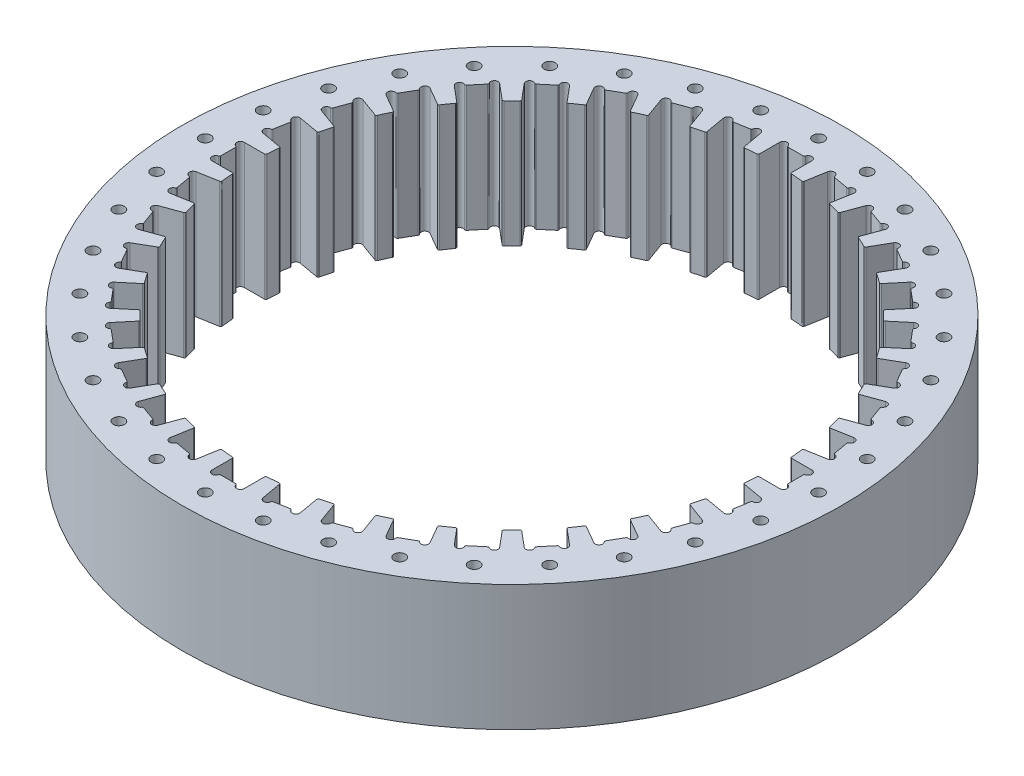
from build123d import *

# Parameters (mm, degrees)
SKETCH1_R           = 66.548
SKETCH1_R_2         = 1.1303
BOSS_EXTRUDE2_DEPTH = 25.4


with BuildPart() as part:
    # Sketch1 → Boss-Extrude2 (new body)
    with BuildSketch(Plane(origin=(0, 0, 0), x_dir=(1, 0, 0), z_dir=(0, 1, 0))):
        with Locations(Location((0, 0, 0), (0, 0, 270))):
            Circle(SKETCH1_R)
        with Locations(Location((30.9626, 53.628796334, 0), (0, 0, 270))):
            Circle(SKETCH1_R_2, mode=Mode.SUBTRACT)
        with Locations(Location((21.179665779, 58.190653481, 0), (0, 0, 270))):
            Circle(SKETCH1_R_2, mode=Mode.SUBTRACT)
        with Locations(Location((39.804751287, 47.437455349, 0), (0, 0, 270))):
            Circle(SKETCH1_R_2, mode=Mode.SUBTRACT)
        with Locations(Location((47.437455349, 39.804751287, 0), (0, 0, 270))):
            Circle(SKETCH1_R_2, mode=Mode.SUBTRACT)
        with Locations(Location((53.628796334, 30.9626, 0), (0, 0, 270))):
            Circle(SKETCH1_R_2, mode=Mode.SUBTRACT)
        with Locations(Location((58.190653481, 21.179665779, 0), (0, 0, 270))):
            Circle(SKETCH1_R_2, mode=Mode.SUBTRACT)
        with Locations(Location((60.984417067, 10.753198132, 0), (0, 0, 270))):
            Circle(SKETCH1_R_2, mode=Mode.SUBTRACT)
        with Locations(Location((61.9252, 0, 0), (0, 0, 270))):
            Circle(SKETCH1_R_2, mode=Mode.SUBTRACT)
        with Locations(Location((60.984417067, -10.753198132, 0), (0, 0, 270))):
            Circle(SKETCH1_R_2, mode=Mode.SUBTRACT)
        with Locations(Location((58.190653481, -21.179665779, 0), (0, 0, 270))):
            Circle(SKETCH1_R_2, mode=Mode.SUBTRACT)
        with Locations(Location((53.628796334, -30.9626, 0), (0, 0, 270))):
            Circle(SKETCH1_R_2, mode=Mode.SUBTRACT)
        with Locations(Location((47.437455349, -39.804751287, 0), (0, 0, 270))):
            Circle(SKETCH1_R_2, mode=Mode.SUBTRACT)
        with Locations(Location((39.804751287, -47.437455349, 0), (0, 0, 270))):
            Circle(SKETCH1_R_2, mode=Mode.SUBTRACT)
        with Locations(Location((30.9626, -53.628796334, 0), (0, 0, 270))):
            Circle(SKETCH1_R_2, mode=Mode.SUBTRACT)
        with Locations(Location((21.179665779, -58.190653481, 0), (0, 0, 270))):
            Circle(SKETCH1_R_2, mode=Mode.SUBTRACT)
        with Locations(Location((10.753198132, -60.984417067, 0), (0, 0, 270))):
            Circle(SKETCH1_R_2, mode=Mode.SUBTRACT)
        with Locations(Location((0, -61.9252, 0), (0, 0, 270))):
            Circle(SKETCH1_R_2, mode=Mode.SUBTRACT)
        with Locations(Location((-10.753198132, -60.984417067, 0), (0, 0, 270))):
            Circle(SKETCH1_R_2, mode=Mode.SUBTRACT)
        with Locations(Location((-21.179665779, -58.190653481, 0), (0, 0, 270))):
            Circle(SKETCH1_R_2, mode=Mode.SUBTRACT)
        with Locations(Location((-30.9626, -53.628796334, 0), (0, 0, 270))):
            Circle(SKETCH1_R_2, mode=Mode.SUBTRACT)
        with Locations(Location((-39.804751287, -47.437455349, 0), (0, 0, 270))):
            Circle(SKETCH1_R_2, mode=Mode.SUBTRACT)
        with Locations(Location((-47.437455349, -39.804751287, 0), (0, 0, 270))):
            Circle(SKETCH1_R_2, mode=Mode.SUBTRACT)
        with Locations(Location((-53.628796334, -30.9626, 0), (0, 0, 270))):
            Circle(SKETCH1_R_2, mode=Mode.SUBTRACT)
        with Locations(Location((-58.190653481, -21.179665779, 0), (0, 0, 270))):
            Circle(SKETCH1_R_2, mode=Mode.SUBTRACT)
        with Locations(Location((-60.984417067, -10.753198132, 0), (0, 0, 270))):
            Circle(SKETCH1_R_2, mode=Mode.SUBTRACT)
        with Locations(Location((-61.9252, 0, 0), (0, 0, 270))):
            Circle(SKETCH1_R_2, mode=Mode.SUBTRACT)
        with Locations(Location((-60.984417067, 10.753198132, 0), (0, 0, 270))):
            Circle(SKETCH1_R_2, mode=Mode.SUBTRACT)
        with Locations(Location((-58.190653481, 21.179665779, 0), (0, 0, 270))):
            Circle(SKETCH1_R_2, mode=Mode.SUBTRACT)
        with Locations(Location((-53.628796334, 30.9626, 0), (0, 0, 270))):
            Circle(SKETCH1_R_2, mode=Mode.SUBTRACT)
        with Locations(Location((-47.437455349, 39.804751287, 0), (0, 0, 270))):
            Circle(SKETCH1_R_2, mode=Mode.SUBTRACT)
        with Locations(Location((-39.804751287, 47.437455349, 0), (0, 0, 270))):
            Circle(SKETCH1_R_2, mode=Mode.SUBTRACT)
        with Locations(Location((-30.9626, 53.628796334, 0), (0, 0, 270))):
            Circle(SKETCH1_R_2, mode=Mode.SUBTRACT)
        with Locations(Location((-21.179665779, 58.190653481, 0), (0, 0, 270))):
            Circle(SKETCH1_R_2, mode=Mode.SUBTRACT)
        with Locations(Location((-10.753198132, 60.984417067, 0), (0, 0, 270))):
            Circle(SKETCH1_R_2, mode=Mode.SUBTRACT)
        with Locations(Location((0, 61.9252, 0), (0, 0, 270))):
            Circle(SKETCH1_R_2, mode=Mode.SUBTRACT)
        with Locations(Location((10.753198132, 60.984417067, 0), (0, 0, 270))):
            Circle(SKETCH1_R_2, mode=Mode.SUBTRACT)
        with BuildLine():
            Line((12.444179916, 51.851536724), (13.152264302, 55.867282831))
            ThreePointArc((13.152264302, 55.867282831), (12.627662659, 56.727372269), (11.708326336, 56.315326823))
            ThreePointArc((11.708326336, 56.315326823), (11.595465048, 56.195804536), (11.433048212, 56.170427013))
            Line((11.433048212, 56.170427013), (8.46786646, 56.693268559))
            ThreePointArc((8.46786646, 56.693268559), (8.323924181, 56.772665459), (8.258748292, 56.923580504))
            ThreePointArc((8.258748292, 56.923580504), (7.535782575, 57.625208111), (6.748650369, 56.996412741))
            Line((6.748650369, 56.996412741), (6.040565983, 52.980666634))
            ThreePointArc((6.040565983, 52.980666634), (5.942874586, 52.82161061), (5.762851362, 52.772274351))
            ThreePointArc((5.762851362, 52.772274351), (4.626749759, 52.883991743), (3.488508571, 52.971253562))
            ThreePointArc((3.488508571, 52.971253562), (3.319787456, 53.051100998), (3.2512, 53.224704536))
            Line((3.2512, 53.224704536), (3.2512, 57.3024))
            ThreePointArc((3.2512, 57.3024), (2.585215271, 58.058326627), (1.751396673, 57.4929))
            ThreePointArc((1.751396673, 57.4929), (1.661004829, 57.355595369), (1.50546223, 57.3024))
            Line((1.50546223, 57.3024), (-1.50546223, 57.3024))
            ThreePointArc((-1.50546223, 57.3024), (-1.661004829, 57.355595369), (-1.751396673, 57.4929))
            ThreePointArc((-1.751396673, 57.4929), (-2.585215271, 58.058326629), (-3.2512, 57.3024))
            Line((-3.2512, 57.3024), (-3.2512, 53.224704536))
            ThreePointArc((-3.2512, 53.224704536), (-3.319787456, 53.051100998), (-3.488508572, 52.971253562))
            ThreePointArc((-3.488508572, 52.971253562), (-4.62674976, 52.883991743), (-5.762851362, 52.772274351))
            ThreePointArc((-5.762851362, 52.772274351), (-5.942874586, 52.82161061), (-6.040565983, 52.980666634))
            Line((-6.040565983, 52.980666634), (-6.748650369, 56.996412741))
            ThreePointArc((-6.748650369, 56.996412741), (-7.535782575, 57.62520811), (-8.258748292, 56.923580504))
            ThreePointArc((-8.258748292, 56.923580504), (-8.323924181, 56.772665459), (-8.46786646, 56.693268559))
            Line((-8.46786646, 56.693268559), (-11.433048212, 56.170427013))
            ThreePointArc((-11.433048212, 56.170427013), (-11.595465048, 56.195804536), (-11.708326336, 56.315326823))
            ThreePointArc((-11.708326336, 56.315326823), (-12.62766266, 56.72737227), (-13.152264303, 55.867282831))
            Line((-13.152264303, 55.867282831), (-12.444179916, 51.851536724))
            ThreePointArc((-12.444179916, 51.851536724), (-12.481579437, 51.668660526), (-12.633871938, 51.560728039))
            ThreePointArc((-12.633871938, 51.560728039), (-13.739667828, 51.277138414), (-14.839109973, 50.969836288))
            ThreePointArc((-14.839109973, 50.969836288), (-15.024965392, 50.987162314), (-15.148792425, 51.126837986))
            Line((-15.148792425, 51.126837986), (-16.543446412, 54.958618323))
            ThreePointArc((-16.543446412, 54.958618323), (-17.427809481, 55.441176804), (-18.017955369, 54.624666819))
            ThreePointArc((-18.017955369, 54.624666819), (-18.055934968, 54.464726838), (-18.183903312, 54.361540841))
            Line((-18.183903312, 54.361540841), (-21.01324681, 53.331744026))
            ThreePointArc((-21.01324681, 53.331744026), (-21.177602929, 53.328532619), (-21.309504428, 53.426640937))
            ThreePointArc((-21.309504428, 53.426640937), (-22.286424908, 53.672785411), (-22.65370371, 52.734666543))
            Line((-22.65370371, 52.734666543), (-21.259049723, 48.902886206))
            ThreePointArc((-21.259049723, 48.902886206), (-21.264124942, 48.71629395), (-21.395361498, 48.583555884))
            ThreePointArc((-21.395361498, 48.583555884), (-22.435113043, 48.112255183), (-23.464489737, 47.618705541))
            ThreePointArc((-23.464489737, 47.618705541), (-23.650530227, 47.603494891), (-23.796730475, 47.719546237))
            Line((-23.796730475, 47.719546237), (-25.835578207, 51.250934098))
            ThreePointArc((-25.835578207, 51.250934098), (-26.790301215, 51.572593396), (-27.229695989, 50.666010274))
            ThreePointArc((-27.229695989, 50.666010274), (-27.239325307, 50.501905053), (-27.347431464, 50.378065213))
            Line((-27.347431464, 50.378065213), (-29.954968536, 48.872602983))
            ThreePointArc((-29.954968536, 48.872602983), (-30.116270062, 48.840900224), (-30.263204011, 48.914613601))
            ThreePointArc((-30.263204011, 48.914613601), (-31.268025413, 48.987378126), (-31.466821793, 47.999734098))
            Line((-31.466821793, 47.999734098), (-29.427974061, 44.468346237))
            ThreePointArc((-29.427974061, 44.468346237), (-29.400570771, 44.283707435), (-29.506763825, 44.130196969))
            ThreePointArc((-29.506763825, 44.130196969), (-30.4488787, 43.485505423), (-31.376912854, 42.820704522))
            ThreePointArc((-31.376912854, 42.820704522), (-31.557485669, 42.773419364), (-31.721616912, 42.862320223))
            Line((-31.721616912, 42.862320223), (-34.342709032, 45.986016174))
            ThreePointArc((-34.342709032, 45.986016174), (-35.338783203, 46.137002834), (-35.614076076, 45.167892645))
            ThreePointArc((-35.614076076, 45.167892645), (-35.59506253, 45.004608438), (-35.68002175, 44.863877566))
            Line((-35.68002175, 44.863877566), (-37.986523701, 42.928492629))
            ThreePointArc((-37.986523701, 42.928492629), (-38.139869568, 42.86926179), (-38.297371454, 42.916340483))
            ThreePointArc((-38.297371454, 42.916340483), (-39.299562789, 42.813514146), (-39.323836419, 41.806354021))
            Line((-39.323836419, 41.806354021), (-36.702744299, 38.68265807))
            ThreePointArc((-36.702744299, 38.68265807), (-36.643695135, 38.505582877), (-36.721618065, 38.33596435))
            ThreePointArc((-36.721618065, 38.33596435), (-37.537470586, 37.537470586), (-38.33596435, 36.721618065))
            ThreePointArc((-38.33596435, 36.721618065), (-38.505582877, 36.643695135), (-38.68265807, 36.702744298))
            Line((-38.68265807, 36.702744298), (-41.806354021, 39.323836419))
            ThreePointArc((-41.806354021, 39.323836419), (-42.813514145, 39.299562788), (-42.916340483, 38.297371454))
            ThreePointArc((-42.916340483, 38.297371454), (-42.86926179, 38.139869568), (-42.928492629, 37.986523701))
            Line((-42.928492629, 37.986523701), (-44.863877566, 35.68002175))
            ThreePointArc((-44.863877566, 35.68002175), (-45.004608438, 35.59506253), (-45.167892645, 35.614076076))
            ThreePointArc((-45.167892645, 35.614076076), (-46.137002835, 35.338783203), (-45.986016174, 34.342709032))
            Line((-45.986016174, 34.342709032), (-42.862320223, 31.721616911))
            ThreePointArc((-42.862320223, 31.721616911), (-42.773419364, 31.557485668), (-42.820704522, 31.376912853))
            ThreePointArc((-42.820704522, 31.376912853), (-43.485505423, 30.4488787), (-44.13019697, 29.506763825))
            ThreePointArc((-44.13019697, 29.506763825), (-44.283707435, 29.400570771), (-44.468346237, 29.427974061))
            Line((-44.468346237, 29.427974061), (-47.999734098, 31.466821793))
            ThreePointArc((-47.999734098, 31.466821793), (-48.987378125, 31.268025412), (-48.914613601, 30.263204011))
            ThreePointArc((-48.914613601, 30.263204011), (-48.840900224, 30.116270062), (-48.872602983, 29.954968536))
            Line((-48.872602983, 29.954968536), (-50.378065213, 27.347431464))
            ThreePointArc((-50.378065213, 27.347431464), (-50.501905053, 27.239325307), (-50.666010274, 27.229695989))
            ThreePointArc((-50.666010274, 27.229695989), (-51.572593397, 26.790301215), (-51.250934098, 25.835578207))
            Line((-51.250934098, 25.835578207), (-47.719546237, 23.796730475))
            ThreePointArc((-47.719546237, 23.796730475), (-47.603494891, 23.650530227), (-47.618705541, 23.464489737))
            ThreePointArc((-47.618705541, 23.464489737), (-48.112255183, 22.435113043), (-48.583555885, 21.395361497))
            ThreePointArc((-48.583555885, 21.395361497), (-48.716293951, 21.264124942), (-48.902886206, 21.259049722))
            Line((-48.902886206, 21.259049722), (-52.734666543, 22.653703709))
            ThreePointArc((-52.734666543, 22.653703709), (-53.67278541, 22.286424907), (-53.426640937, 21.309504428))
            ThreePointArc((-53.426640937, 21.309504428), (-53.328532619, 21.177602929), (-53.331744026, 21.01324681))
            Line((-53.331744026, 21.01324681), (-54.361540841, 18.183903312))
            ThreePointArc((-54.361540841, 18.183903312), (-54.464726838, 18.055934968), (-54.624666819, 18.017955369))
            ThreePointArc((-54.624666819, 18.017955369), (-55.441176806, 17.427809481), (-54.958618323, 16.543446412))
            Line((-54.958618323, 16.543446412), (-51.126837986, 15.148792425))
            ThreePointArc((-51.126837986, 15.148792425), (-50.987162314, 15.024965392), (-50.969836288, 14.839109973))
            ThreePointArc((-50.969836288, 14.839109973), (-51.277138414, 13.739667828), (-51.560728039, 12.633871937))
            ThreePointArc((-51.560728039, 12.633871937), (-51.668660526, 12.481579436), (-51.851536724, 12.444179916))
            Line((-51.851536724, 12.444179916), (-55.867282831, 13.152264302))
            ThreePointArc((-55.867282831, 13.152264302), (-56.727372269, 12.627662659), (-56.315326823, 11.708326336))
            ThreePointArc((-56.315326823, 11.708326336), (-56.195804536, 11.595465048), (-56.170427013, 11.433048212))
            Line((-56.170427013, 11.433048212), (-56.693268559, 8.46786646))
            ThreePointArc((-56.693268559, 8.46786646), (-56.772665459, 8.323924181), (-56.923580504, 8.258748292))
            ThreePointArc((-56.923580504, 8.258748292), (-57.625208111, 7.535782575), (-56.996412741, 6.748650369))
            Line((-56.996412741, 6.748650369), (-52.980666634, 6.040565983))
            ThreePointArc((-52.980666634, 6.040565983), (-52.82161061, 5.942874586), (-52.772274351, 5.762851362))
            ThreePointArc((-52.772274351, 5.762851362), (-52.883991743, 4.626749759), (-52.971253562, 3.488508571))
            ThreePointArc((-52.971253562, 3.488508571), (-53.051100998, 3.319787456), (-53.224704536, 3.2512))
            Line((-53.224704536, 3.2512), (-57.3024, 3.2512))
            ThreePointArc((-57.3024, 3.2512), (-58.058326627, 2.585215271), (-57.4929, 1.751396673))
            ThreePointArc((-57.4929, 1.751396673), (-57.355595369, 1.661004829), (-57.3024, 1.50546223))
            Line((-57.3024, 1.50546223), (-57.3024, -1.50546223))
            ThreePointArc((-57.3024, -1.50546223), (-57.355595369, -1.661004829), (-57.4929, -1.751396673))
            ThreePointArc((-57.4929, -1.751396673), (-58.058326629, -2.585215271), (-57.3024, -3.2512))
            Line((-57.3024, -3.2512), (-53.224704536, -3.2512))
            ThreePointArc((-53.224704536, -3.2512), (-53.051100998, -3.319787456), (-52.971253562, -3.488508572))
            ThreePointArc((-52.971253562, -3.488508572), (-52.883991743, -4.62674976), (-52.772274351, -5.762851362))
            ThreePointArc((-52.772274351, -5.762851362), (-52.82161061, -5.942874586), (-52.980666634, -6.040565983))
            Line((-52.980666634, -6.040565983), (-56.996412741, -6.748650369))
            ThreePointArc((-56.996412741, -6.748650369), (-57.62520811, -7.535782575), (-56.923580504, -8.258748292))
            ThreePointArc((-56.923580504, -8.258748292), (-56.772665459, -8.323924181), (-56.693268559, -8.46786646))
            Line((-56.693268559, -8.46786646), (-56.170427013, -11.433048212))
            ThreePointArc((-56.170427013, -11.433048212), (-56.195804536, -11.595465048), (-56.315326823, -11.708326336))
            ThreePointArc((-56.315326823, -11.708326336), (-56.72737227, -12.62766266), (-55.867282831, -13.152264303))
            Line((-55.867282831, -13.152264303), (-51.851536724, -12.444179916))
            ThreePointArc((-51.851536724, -12.444179916), (-51.668660526, -12.481579437), (-51.560728039, -12.633871938))
            ThreePointArc((-51.560728039, -12.633871938), (-51.277138414, -13.739667828), (-50.969836288, -14.839109973))
            ThreePointArc((-50.969836288, -14.839109973), (-50.987162314, -15.024965392), (-51.126837986, -15.148792425))
            Line((-51.126837986, -15.148792425), (-54.958618323, -16.543446412))
            ThreePointArc((-54.958618323, -16.543446412), (-55.441176804, -17.427809481), (-54.624666819, -18.017955369))
            ThreePointArc((-54.624666819, -18.017955369), (-54.464726838, -18.055934968), (-54.361540841, -18.183903312))
            Line((-54.361540841, -18.183903312), (-53.331744026, -21.01324681))
            ThreePointArc((-53.331744026, -21.01324681), (-53.328532619, -21.177602929), (-53.426640937, -21.309504428))
            ThreePointArc((-53.426640937, -21.309504428), (-53.672785411, -22.286424908), (-52.734666543, -22.65370371))
            Line((-52.734666543, -22.65370371), (-48.902886206, -21.259049723))
            ThreePointArc((-48.902886206, -21.259049723), (-48.71629395, -21.264124942), (-48.583555884, -21.395361498))
            ThreePointArc((-48.583555884, -21.395361498), (-48.112255183, -22.435113043), (-47.618705541, -23.464489737))
            ThreePointArc((-47.618705541, -23.464489737), (-47.603494891, -23.650530227), (-47.719546237, -23.796730475))
            Line((-47.719546237, -23.796730475), (-51.250934098, -25.835578207))
            ThreePointArc((-51.250934098, -25.835578207), (-51.572593396, -26.790301215), (-50.666010274, -27.229695989))
            ThreePointArc((-50.666010274, -27.229695989), (-50.501905053, -27.239325307), (-50.378065213, -27.347431464))
            Line((-50.378065213, -27.347431464), (-48.872602983, -29.954968536))
            ThreePointArc((-48.872602983, -29.954968536), (-48.840900224, -30.116270062), (-48.914613601, -30.263204011))
            ThreePointArc((-48.914613601, -30.263204011), (-48.987378126, -31.268025413), (-47.999734098, -31.466821793))
            Line((-47.999734098, -31.466821793), (-44.468346237, -29.427974061))
            ThreePointArc((-44.468346237, -29.427974061), (-44.283707435, -29.400570771), (-44.130196969, -29.506763825))
            ThreePointArc((-44.130196969, -29.506763825), (-43.485505423, -30.4488787), (-42.820704522, -31.376912854))
            ThreePointArc((-42.820704522, -31.376912854), (-42.773419364, -31.557485669), (-42.862320223, -31.721616912))
            Line((-42.862320223, -31.721616912), (-45.986016174, -34.342709032))
            ThreePointArc((-45.986016174, -34.342709032), (-46.137002834, -35.338783203), (-45.167892645, -35.614076076))
            ThreePointArc((-45.167892645, -35.614076076), (-45.004608438, -35.59506253), (-44.863877566, -35.68002175))
            Line((-44.863877566, -35.68002175), (-42.928492629, -37.986523701))
            ThreePointArc((-42.928492629, -37.986523701), (-42.86926179, -38.139869568), (-42.916340483, -38.297371454))
            ThreePointArc((-42.916340483, -38.297371454), (-42.813514146, -39.299562789), (-41.806354021, -39.323836419))
            Line((-41.806354021, -39.323836419), (-38.68265807, -36.702744299))
            ThreePointArc((-38.68265807, -36.702744299), (-38.505582877, -36.643695135), (-38.33596435, -36.721618065))
            ThreePointArc((-38.33596435, -36.721618065), (-37.537470586, -37.537470586), (-36.721618065, -38.33596435))
            ThreePointArc((-36.721618065, -38.33596435), (-36.643695135, -38.505582877), (-36.702744298, -38.68265807))
            Line((-36.702744298, -38.68265807), (-39.323836419, -41.806354021))
            ThreePointArc((-39.323836419, -41.806354021), (-39.299562788, -42.813514145), (-38.297371454, -42.916340483))
            ThreePointArc((-38.297371454, -42.916340483), (-38.139869568, -42.86926179), (-37.986523701, -42.928492629))
            Line((-37.986523701, -42.928492629), (-35.68002175, -44.863877566))
            ThreePointArc((-35.68002175, -44.863877566), (-35.59506253, -45.004608438), (-35.614076076, -45.167892645))
            ThreePointArc((-35.614076076, -45.167892645), (-35.338783203, -46.137002835), (-34.342709032, -45.986016174))
            Line((-34.342709032, -45.986016174), (-31.721616911, -42.862320223))
            ThreePointArc((-31.721616911, -42.862320223), (-31.557485668, -42.773419364), (-31.376912853, -42.820704522))
            ThreePointArc((-31.376912853, -42.820704522), (-30.4488787, -43.485505423), (-29.506763825, -44.13019697))
            ThreePointArc((-29.506763825, -44.13019697), (-29.400570771, -44.283707435), (-29.427974061, -44.468346237))
            Line((-29.427974061, -44.468346237), (-31.466821793, -47.999734098))
            ThreePointArc((-31.466821793, -47.999734098), (-31.268025412, -48.987378125), (-30.263204011, -48.914613601))
            ThreePointArc((-30.263204011, -48.914613601), (-30.116270062, -48.840900224), (-29.954968536, -48.872602983))
            Line((-29.954968536, -48.872602983), (-27.347431464, -50.378065213))
            ThreePointArc((-27.347431464, -50.378065213), (-27.239325307, -50.501905053), (-27.229695989, -50.666010274))
            ThreePointArc((-27.229695989, -50.666010274), (-26.790301215, -51.572593397), (-25.835578207, -51.250934098))
            Line((-25.835578207, -51.250934098), (-23.796730475, -47.719546237))
            ThreePointArc((-23.796730475, -47.719546237), (-23.650530227, -47.603494891), (-23.464489737, -47.618705541))
            ThreePointArc((-23.464489737, -47.618705541), (-22.435113043, -48.112255183), (-21.395361497, -48.583555885))
            ThreePointArc((-21.395361497, -48.583555885), (-21.264124942, -48.716293951), (-21.259049722, -48.902886206))
            Line((-21.259049722, -48.902886206), (-22.653703709, -52.734666543))
            ThreePointArc((-22.653703709, -52.734666543), (-22.286424907, -53.67278541), (-21.309504428, -53.426640937))
            ThreePointArc((-21.309504428, -53.426640937), (-21.177602929, -53.328532619), (-21.01324681, -53.331744026))
            Line((-21.01324681, -53.331744026), (-18.183903312, -54.361540841))
            ThreePointArc((-18.183903312, -54.361540841), (-18.055934968, -54.464726838), (-18.017955369, -54.624666819))
            ThreePointArc((-18.017955369, -54.624666819), (-17.427809481, -55.441176806), (-16.543446412, -54.958618323))
            Line((-16.543446412, -54.958618323), (-15.148792425, -51.126837986))
            ThreePointArc((-15.148792425, -51.126837986), (-15.024965392, -50.987162314), (-14.839109973, -50.969836288))
            ThreePointArc((-14.839109973, -50.969836288), (-13.739667828, -51.277138414), (-12.633871937, -51.560728039))
            ThreePointArc((-12.633871937, -51.560728039), (-12.481579436, -51.668660526), (-12.444179916, -51.851536724))
            Line((-12.444179916, -51.851536724), (-13.152264302, -55.867282831))
            ThreePointArc((-13.152264302, -55.867282831), (-12.627662659, -56.727372269), (-11.708326336, -56.315326823))
            ThreePointArc((-11.708326336, -56.315326823), (-11.595465048, -56.195804536), (-11.433048212, -56.170427013))
            Line((-11.433048212, -56.170427013), (-8.46786646, -56.693268559))
            ThreePointArc((-8.46786646, -56.693268559), (-8.323924181, -56.772665459), (-8.258748292, -56.923580504))
            ThreePointArc((-8.258748292, -56.923580504), (-7.535782575, -57.625208111), (-6.748650369, -56.996412741))
            Line((-6.748650369, -56.996412741), (-6.040565983, -52.980666634))
            ThreePointArc((-6.040565983, -52.980666634), (-5.942874586, -52.82161061), (-5.762851362, -52.772274351))
            ThreePointArc((-5.762851362, -52.772274351), (-4.626749759, -52.883991743), (-3.488508571, -52.971253562))
            ThreePointArc((-3.488508571, -52.971253562), (-3.319787456, -53.051100998), (-3.2512, -53.224704536))
            Line((-3.2512, -53.224704536), (-3.2512, -57.3024))
            ThreePointArc((-3.2512, -57.3024), (-2.585215271, -58.058326627), (-1.751396673, -57.4929))
            ThreePointArc((-1.751396673, -57.4929), (-1.661004829, -57.355595369), (-1.50546223, -57.3024))
            Line((-1.50546223, -57.3024), (1.50546223, -57.3024))
            ThreePointArc((1.50546223, -57.3024), (1.661004829, -57.355595369), (1.751396673, -57.4929))
            ThreePointArc((1.751396673, -57.4929), (2.585215271, -58.058326629), (3.2512, -57.3024))
            Line((3.2512, -57.3024), (3.2512, -53.224704536))
            ThreePointArc((3.2512, -53.224704536), (3.319787456, -53.051100998), (3.488508572, -52.971253562))
            ThreePointArc((3.488508572, -52.971253562), (4.62674976, -52.883991743), (5.762851362, -52.772274351))
            ThreePointArc((5.762851362, -52.772274351), (5.942874586, -52.82161061), (6.040565983, -52.980666634))
            Line((6.040565983, -52.980666634), (6.748650369, -56.996412741))
            ThreePointArc((6.748650369, -56.996412741), (7.535782575, -57.62520811), (8.258748292, -56.923580504))
            ThreePointArc((8.258748292, -56.923580504), (8.323924181, -56.772665459), (8.46786646, -56.693268559))
            Line((8.46786646, -56.693268559), (11.433048212, -56.170427013))
            ThreePointArc((11.433048212, -56.170427013), (11.595465048, -56.195804536), (11.708326336, -56.315326823))
            ThreePointArc((11.708326336, -56.315326823), (12.62766266, -56.72737227), (13.152264303, -55.867282831))
            Line((13.152264303, -55.867282831), (12.444179916, -51.851536724))
            ThreePointArc((12.444179916, -51.851536724), (12.481579437, -51.668660526), (12.633871938, -51.560728039))
            ThreePointArc((12.633871938, -51.560728039), (13.739667828, -51.277138414), (14.839109973, -50.969836288))
            ThreePointArc((14.839109973, -50.969836288), (15.024965392, -50.987162314), (15.148792425, -51.126837986))
            Line((15.148792425, -51.126837986), (16.543446412, -54.958618323))
            ThreePointArc((16.543446412, -54.958618323), (17.427809481, -55.441176804), (18.017955369, -54.624666819))
            ThreePointArc((18.017955369, -54.624666819), (18.055934968, -54.464726838), (18.183903312, -54.361540841))
            Line((18.183903312, -54.361540841), (21.01324681, -53.331744026))
            ThreePointArc((21.01324681, -53.331744026), (21.177602929, -53.328532619), (21.309504428, -53.426640937))
            ThreePointArc((21.309504428, -53.426640937), (22.286424908, -53.672785411), (22.65370371, -52.734666543))
            Line((22.65370371, -52.734666543), (21.259049723, -48.902886206))
            ThreePointArc((21.259049723, -48.902886206), (21.264124942, -48.71629395), (21.395361498, -48.583555884))
            ThreePointArc((21.395361498, -48.583555884), (22.435113043, -48.112255183), (23.464489737, -47.618705541))
            ThreePointArc((23.464489737, -47.618705541), (23.650530227, -47.603494891), (23.796730475, -47.719546237))
            Line((23.796730475, -47.719546237), (25.835578207, -51.250934098))
            ThreePointArc((25.835578207, -51.250934098), (26.790301215, -51.572593396), (27.229695989, -50.666010274))
            ThreePointArc((27.229695989, -50.666010274), (27.239325307, -50.501905053), (27.347431464, -50.378065213))
            Line((27.347431464, -50.378065213), (29.954968536, -48.872602983))
            ThreePointArc((29.954968536, -48.872602983), (30.116270062, -48.840900224), (30.263204011, -48.914613601))
            ThreePointArc((30.263204011, -48.914613601), (31.268025413, -48.987378126), (31.466821793, -47.999734098))
            Line((31.466821793, -47.999734098), (29.427974061, -44.468346237))
            ThreePointArc((29.427974061, -44.468346237), (29.400570771, -44.283707435), (29.506763825, -44.130196969))
            ThreePointArc((29.506763825, -44.130196969), (30.4488787, -43.485505423), (31.376912854, -42.820704522))
            ThreePointArc((31.376912854, -42.820704522), (31.557485669, -42.773419364), (31.721616912, -42.862320223))
            Line((31.721616912, -42.862320223), (34.342709032, -45.986016174))
            ThreePointArc((34.342709032, -45.986016174), (35.338783203, -46.137002834), (35.614076076, -45.167892645))
            ThreePointArc((35.614076076, -45.167892645), (35.59506253, -45.004608438), (35.68002175, -44.863877566))
            Line((35.68002175, -44.863877566), (37.986523701, -42.928492629))
            ThreePointArc((37.986523701, -42.928492629), (38.139869568, -42.86926179), (38.297371454, -42.916340483))
            ThreePointArc((38.297371454, -42.916340483), (39.299562789, -42.813514146), (39.323836419, -41.806354021))
            Line((39.323836419, -41.806354021), (36.702744299, -38.68265807))
            ThreePointArc((36.702744299, -38.68265807), (36.643695135, -38.505582877), (36.721618065, -38.33596435))
            ThreePointArc((36.721618065, -38.33596435), (37.537470586, -37.537470586), (38.33596435, -36.721618065))
            ThreePointArc((38.33596435, -36.721618065), (38.505582877, -36.643695135), (38.68265807, -36.702744298))
            Line((38.68265807, -36.702744298), (41.806354021, -39.323836419))
            ThreePointArc((41.806354021, -39.323836419), (42.813514145, -39.299562788), (42.916340483, -38.297371454))
            ThreePointArc((42.916340483, -38.297371454), (42.86926179, -38.139869568), (42.928492629, -37.986523701))
            Line((42.928492629, -37.986523701), (44.863877566, -35.68002175))
            ThreePointArc((44.863877566, -35.68002175), (45.004608438, -35.59506253), (45.167892645, -35.614076076))
            ThreePointArc((45.167892645, -35.614076076), (46.137002835, -35.338783203), (45.986016174, -34.342709032))
            Line((45.986016174, -34.342709032), (42.862320223, -31.721616911))
            ThreePointArc((42.862320223, -31.721616911), (42.773419364, -31.557485668), (42.820704522, -31.376912853))
            ThreePointArc((42.820704522, -31.376912853), (43.485505423, -30.4488787), (44.13019697, -29.506763825))
            ThreePointArc((44.13019697, -29.506763825), (44.283707435, -29.400570771), (44.468346237, -29.427974061))
            Line((44.468346237, -29.427974061), (47.999734098, -31.466821793))
            ThreePointArc((47.999734098, -31.466821793), (48.987378125, -31.268025412), (48.914613601, -30.263204011))
            ThreePointArc((48.914613601, -30.263204011), (48.840900224, -30.116270062), (48.872602983, -29.954968536))
            Line((48.872602983, -29.954968536), (50.378065213, -27.347431464))
            ThreePointArc((50.378065213, -27.347431464), (50.501905053, -27.239325307), (50.666010274, -27.229695989))
            ThreePointArc((50.666010274, -27.229695989), (51.572593397, -26.790301215), (51.250934098, -25.835578207))
            Line((51.250934098, -25.835578207), (47.719546237, -23.796730475))
            ThreePointArc((47.719546237, -23.796730475), (47.603494891, -23.650530227), (47.618705541, -23.464489737))
            ThreePointArc((47.618705541, -23.464489737), (48.112255183, -22.435113043), (48.583555885, -21.395361497))
            ThreePointArc((48.583555885, -21.395361497), (48.716293951, -21.264124942), (48.902886206, -21.259049722))
            Line((48.902886206, -21.259049722), (52.734666543, -22.653703709))
            ThreePointArc((52.734666543, -22.653703709), (53.67278541, -22.286424907), (53.426640937, -21.309504428))
            ThreePointArc((53.426640937, -21.309504428), (53.328532619, -21.177602929), (53.331744026, -21.01324681))
            Line((53.331744026, -21.01324681), (54.361540841, -18.183903312))
            ThreePointArc((54.361540841, -18.183903312), (54.464726838, -18.055934968), (54.624666819, -18.017955369))
            ThreePointArc((54.624666819, -18.017955369), (55.441176806, -17.427809481), (54.958618323, -16.543446412))
            Line((54.958618323, -16.543446412), (51.126837986, -15.148792425))
            ThreePointArc((51.126837986, -15.148792425), (50.987162314, -15.024965392), (50.969836288, -14.839109973))
            ThreePointArc((50.969836288, -14.839109973), (51.277138414, -13.739667828), (51.560728039, -12.633871937))
            ThreePointArc((51.560728039, -12.633871937), (51.668660526, -12.481579436), (51.851536724, -12.444179916))
            Line((51.851536724, -12.444179916), (55.867282831, -13.152264302))
            ThreePointArc((55.867282831, -13.152264302), (56.727372269, -12.627662659), (56.315326823, -11.708326336))
            ThreePointArc((56.315326823, -11.708326336), (56.195804536, -11.595465048), (56.170427013, -11.433048212))
            Line((56.170427013, -11.433048212), (56.693268559, -8.46786646))
            ThreePointArc((56.693268559, -8.46786646), (56.772665459, -8.323924181), (56.923580504, -8.258748292))
            ThreePointArc((56.923580504, -8.258748292), (57.625208111, -7.535782575), (56.996412741, -6.748650369))
            Line((56.996412741, -6.748650369), (52.980666634, -6.040565983))
            ThreePointArc((52.980666634, -6.040565983), (52.82161061, -5.942874586), (52.772274351, -5.762851362))
            ThreePointArc((52.772274351, -5.762851362), (52.883991743, -4.626749759), (52.971253562, -3.488508571))
            ThreePointArc((52.971253562, -3.488508571), (53.051100998, -3.319787456), (53.224704536, -3.2512))
            Line((53.224704536, -3.2512), (57.3024, -3.2512))
            ThreePointArc((57.3024, -3.2512), (58.058326627, -2.585215271), (57.4929, -1.751396673))
            ThreePointArc((57.4929, -1.751396673), (57.355595369, -1.661004829), (57.3024, -1.50546223))
            Line((57.3024, -1.50546223), (57.3024, 1.50546223))
            ThreePointArc((57.3024, 1.50546223), (57.355595369, 1.661004829), (57.4929, 1.751396673))
            ThreePointArc((57.4929, 1.751396673), (58.058326629, 2.585215271), (57.3024, 3.2512))
            Line((57.3024, 3.2512), (53.224704536, 3.2512))
            ThreePointArc((53.224704536, 3.2512), (53.051100998, 3.319787456), (52.971253562, 3.488508572))
            ThreePointArc((52.971253562, 3.488508572), (52.883991743, 4.62674976), (52.772274351, 5.762851362))
            ThreePointArc((52.772274351, 5.762851362), (52.82161061, 5.942874586), (52.980666634, 6.040565983))
            Line((52.980666634, 6.040565983), (56.996412741, 6.748650369))
            ThreePointArc((56.996412741, 6.748650369), (57.62520811, 7.535782575), (56.923580504, 8.258748292))
            ThreePointArc((56.923580504, 8.258748292), (56.772665459, 8.323924181), (56.693268559, 8.46786646))
            Line((56.693268559, 8.46786646), (56.170427013, 11.433048212))
            ThreePointArc((56.170427013, 11.433048212), (56.195804536, 11.595465048), (56.315326823, 11.708326336))
            ThreePointArc((56.315326823, 11.708326336), (56.72737227, 12.62766266), (55.867282831, 13.152264303))
            Line((55.867282831, 13.152264303), (51.851536724, 12.444179916))
            ThreePointArc((51.851536724, 12.444179916), (51.668660526, 12.481579437), (51.560728039, 12.633871938))
            ThreePointArc((51.560728039, 12.633871938), (51.277138414, 13.739667828), (50.969836288, 14.839109973))
            ThreePointArc((50.969836288, 14.839109973), (50.987162314, 15.024965392), (51.126837986, 15.148792425))
            Line((51.126837986, 15.148792425), (54.958618323, 16.543446412))
            ThreePointArc((54.958618323, 16.543446412), (55.441176804, 17.427809481), (54.624666819, 18.017955369))
            ThreePointArc((54.624666819, 18.017955369), (54.464726838, 18.055934968), (54.361540841, 18.183903312))
            Line((54.361540841, 18.183903312), (53.331744026, 21.01324681))
            ThreePointArc((53.331744026, 21.01324681), (53.328532619, 21.177602929), (53.426640937, 21.309504428))
            ThreePointArc((53.426640937, 21.309504428), (53.672785411, 22.286424908), (52.734666543, 22.65370371))
            Line((52.734666543, 22.65370371), (48.902886206, 21.259049723))
            ThreePointArc((48.902886206, 21.259049723), (48.71629395, 21.264124942), (48.583555884, 21.395361498))
            ThreePointArc((48.583555884, 21.395361498), (48.112255183, 22.435113043), (47.618705541, 23.464489737))
            ThreePointArc((47.618705541, 23.464489737), (47.603494891, 23.650530227), (47.719546237, 23.796730475))
            Line((47.719546237, 23.796730475), (51.250934098, 25.835578207))
            ThreePointArc((51.250934098, 25.835578207), (51.572593396, 26.790301215), (50.666010274, 27.229695989))
            ThreePointArc((50.666010274, 27.229695989), (50.501905053, 27.239325307), (50.378065213, 27.347431464))
            Line((50.378065213, 27.347431464), (48.872602983, 29.954968536))
            ThreePointArc((48.872602983, 29.954968536), (48.840900224, 30.116270062), (48.914613601, 30.263204011))
            ThreePointArc((48.914613601, 30.263204011), (48.987378126, 31.268025413), (47.999734098, 31.466821793))
            Line((47.999734098, 31.466821793), (44.468346237, 29.427974061))
            ThreePointArc((44.468346237, 29.427974061), (44.283707435, 29.400570771), (44.130196969, 29.506763825))
            ThreePointArc((44.130196969, 29.506763825), (43.485505423, 30.4488787), (42.820704522, 31.376912854))
            ThreePointArc((42.820704522, 31.376912854), (42.773419364, 31.557485669), (42.862320223, 31.721616912))
            Line((42.862320223, 31.721616912), (45.986016174, 34.342709032))
            ThreePointArc((45.986016174, 34.342709032), (46.137002834, 35.338783203), (45.167892645, 35.614076076))
            ThreePointArc((45.167892645, 35.614076076), (45.004608438, 35.59506253), (44.863877566, 35.68002175))
            Line((44.863877566, 35.68002175), (42.928492629, 37.986523701))
            ThreePointArc((42.928492629, 37.986523701), (42.86926179, 38.139869568), (42.916340483, 38.297371454))
            ThreePointArc((42.916340483, 38.297371454), (42.813514146, 39.299562789), (41.806354021, 39.323836419))
            Line((41.806354021, 39.323836419), (38.68265807, 36.702744299))
            ThreePointArc((38.68265807, 36.702744299), (38.505582877, 36.643695135), (38.33596435, 36.721618065))
            ThreePointArc((38.33596435, 36.721618065), (37.537470586, 37.537470586), (36.721618065, 38.33596435))
            ThreePointArc((36.721618065, 38.33596435), (36.643695135, 38.505582877), (36.702744298, 38.68265807))
            Line((36.702744298, 38.68265807), (39.323836419, 41.806354021))
            ThreePointArc((39.323836419, 41.806354021), (39.299562788, 42.813514145), (38.297371454, 42.916340483))
            ThreePointArc((38.297371454, 42.916340483), (38.139869568, 42.86926179), (37.986523701, 42.928492629))
            Line((37.986523701, 42.928492629), (35.68002175, 44.863877566))
            ThreePointArc((35.68002175, 44.863877566), (35.59506253, 45.004608438), (35.614076076, 45.167892645))
            ThreePointArc((35.614076076, 45.167892645), (35.338783203, 46.137002835), (34.342709032, 45.986016174))
            Line((34.342709032, 45.986016174), (31.721616911, 42.862320223))
            ThreePointArc((31.721616911, 42.862320223), (31.557485668, 42.773419364), (31.376912853, 42.820704522))
            ThreePointArc((31.376912853, 42.820704522), (30.4488787, 43.485505423), (29.506763825, 44.13019697))
            ThreePointArc((29.506763825, 44.13019697), (29.400570771, 44.283707435), (29.427974061, 44.468346237))
            Line((29.427974061, 44.468346237), (31.466821793, 47.999734098))
            ThreePointArc((31.466821793, 47.999734098), (31.268025412, 48.987378125), (30.263204011, 48.914613601))
            ThreePointArc((30.263204011, 48.914613601), (30.116270062, 48.840900224), (29.954968536, 48.872602983))
            Line((29.954968536, 48.872602983), (27.347431464, 50.378065213))
            ThreePointArc((27.347431464, 50.378065213), (27.239325307, 50.501905053), (27.229695989, 50.666010274))
            ThreePointArc((27.229695989, 50.666010274), (26.790301215, 51.572593397), (25.835578207, 51.250934098))
            Line((25.835578207, 51.250934098), (23.796730475, 47.719546237))
            ThreePointArc((23.796730475, 47.719546237), (23.650530227, 47.603494891), (23.464489737, 47.618705541))
            ThreePointArc((23.464489737, 47.618705541), (22.435113043, 48.112255183), (21.395361497, 48.583555885))
            ThreePointArc((21.395361497, 48.583555885), (21.264124942, 48.716293951), (21.259049722, 48.902886206))
            Line((21.259049722, 48.902886206), (22.653703709, 52.734666543))
            ThreePointArc((22.653703709, 52.734666543), (22.286424907, 53.67278541), (21.309504428, 53.426640937))
            ThreePointArc((21.309504428, 53.426640937), (21.177602929, 53.328532619), (21.01324681, 53.331744026))
            Line((21.01324681, 53.331744026), (18.183903312, 54.361540841))
            ThreePointArc((18.183903312, 54.361540841), (18.055934968, 54.464726838), (18.017955369, 54.624666819))
            ThreePointArc((18.017955369, 54.624666819), (17.427809481, 55.441176806), (16.543446412, 54.958618323))
            Line((16.543446412, 54.958618323), (15.148792425, 51.126837986))
            ThreePointArc((15.148792425, 51.126837986), (15.024965392, 50.987162314), (14.839109973, 50.969836288))
            ThreePointArc((14.839109973, 50.969836288), (13.739667828, 51.277138414), (12.633871937, 51.560728039))
            ThreePointArc((12.633871937, 51.560728039), (12.481579436, 51.668660526), (12.444179916, 51.851536724))
        make_face(mode=Mode.SUBTRACT)
    extrude(amount=BOSS_EXTRUDE2_DEPTH)


solid = part.part
